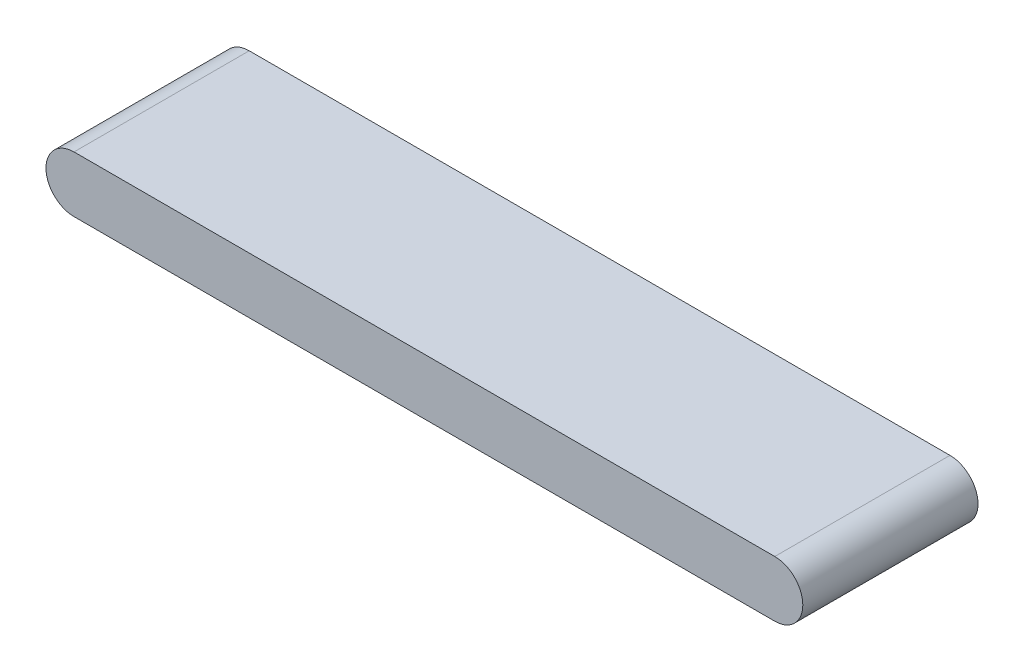
from build123d import *

# Parameters (mm, degrees)
BOSS_EXTRUDE1_DEPTH = 250


with BuildPart() as part:
    # Sketch1 → Boss-Extrude1 (new, symmetric)
    with BuildSketch(Plane.XY):
        with BuildLine():
            Line((-1000, 80), (1000, 80))
            ThreePointArc((1000, 80), (1080, 0), (1000, -80))
            Line((1000, -80), (-1000, -80))
            ThreePointArc((-1000, -80), (-1080, 0), (-1000, 80))
        make_face()
    extrude(amount=BOSS_EXTRUDE1_DEPTH, both=True)


solid = part.part
